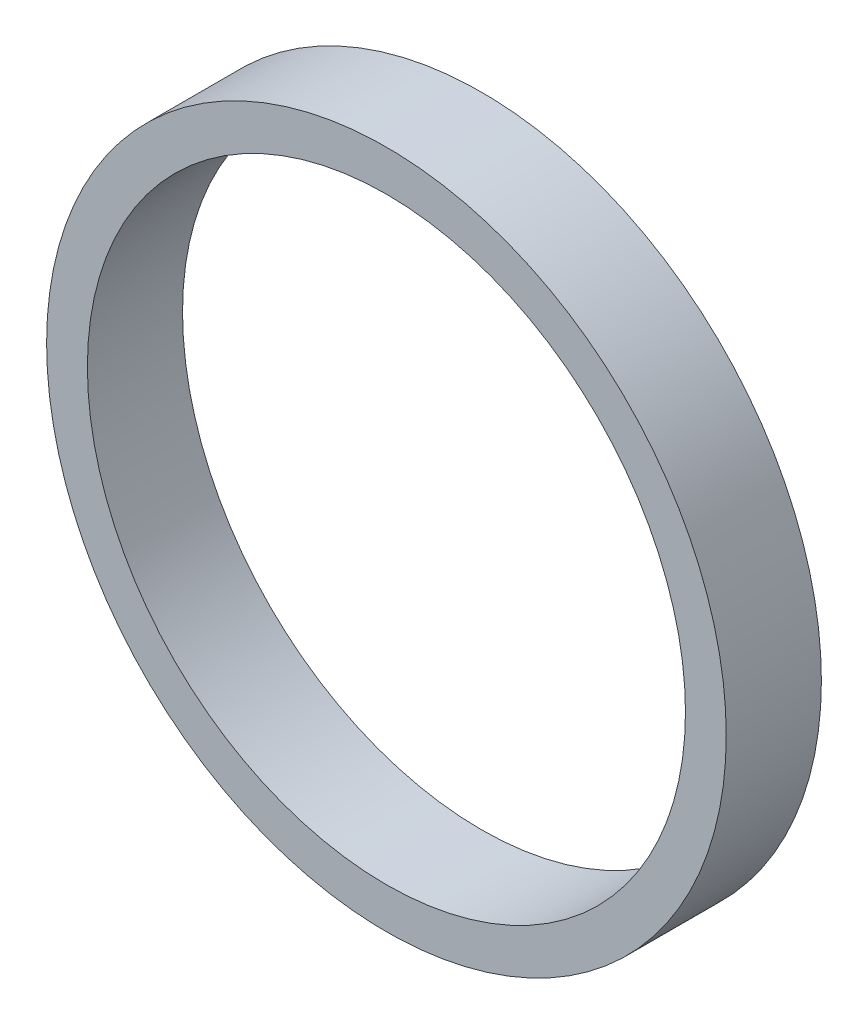
from build123d import *

# Parameters (mm, degrees)
SKETCH1_R           = 12.5
BOSS_EXTRUDE1_DEPTH = 3.5
SKETCH2_R           = 11
CUT_EXTRUDE1_DEPTH  = 3.5


with BuildPart() as part:
    # Sketch1 → Boss-Extrude1 (new body)
    with BuildSketch(Plane.XY):
        Circle(SKETCH1_R)
    extrude(amount=BOSS_EXTRUDE1_DEPTH)

    # Sketch2 → Cut-Extrude1 (cut)
    with BuildSketch(Plane.XY.offset(3.5)):
        Circle(SKETCH2_R)
    extrude(amount=-CUT_EXTRUDE1_DEPTH, mode=Mode.SUBTRACT)


solid = part.part
